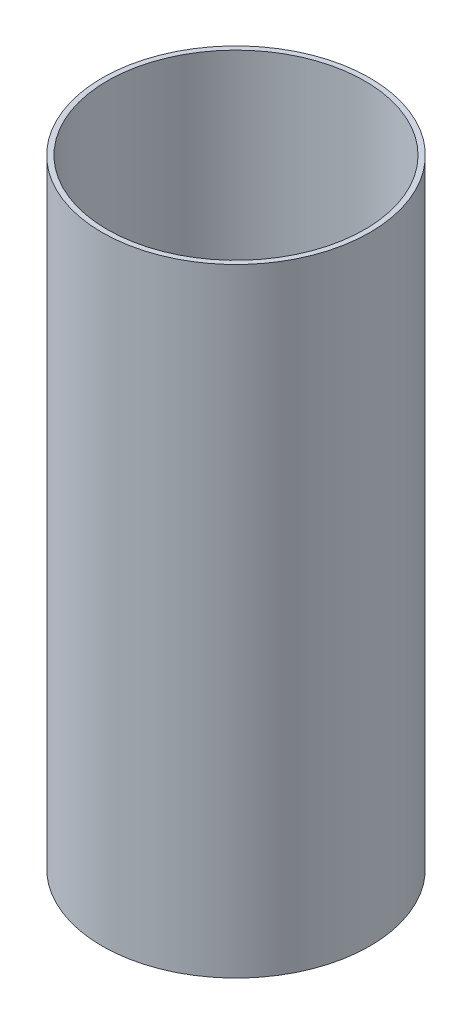
from build123d import *

# Parameters (mm, degrees)
ESBO_O1_R                = 26
ESBO_O1_R_2              = 25
RESSALTO_EXTRUS_O1_DEPTH = 120


with BuildPart() as part:
    # Esboço1 → Ressalto-extrusão1 (new body)
    with BuildSketch(Plane(origin=(0, 0, 0), x_dir=(1, 0, 0), z_dir=(0, 1, 0))):
        with Locations(Location((0, 0, 0), (0, 0, 270))):
            Circle(ESBO_O1_R)
        with Locations(Location((0, 0, 0), (0, 0, 270))):
            Circle(ESBO_O1_R_2, mode=Mode.SUBTRACT)
    extrude(amount=RESSALTO_EXTRUS_O1_DEPTH)


solid = part.part
